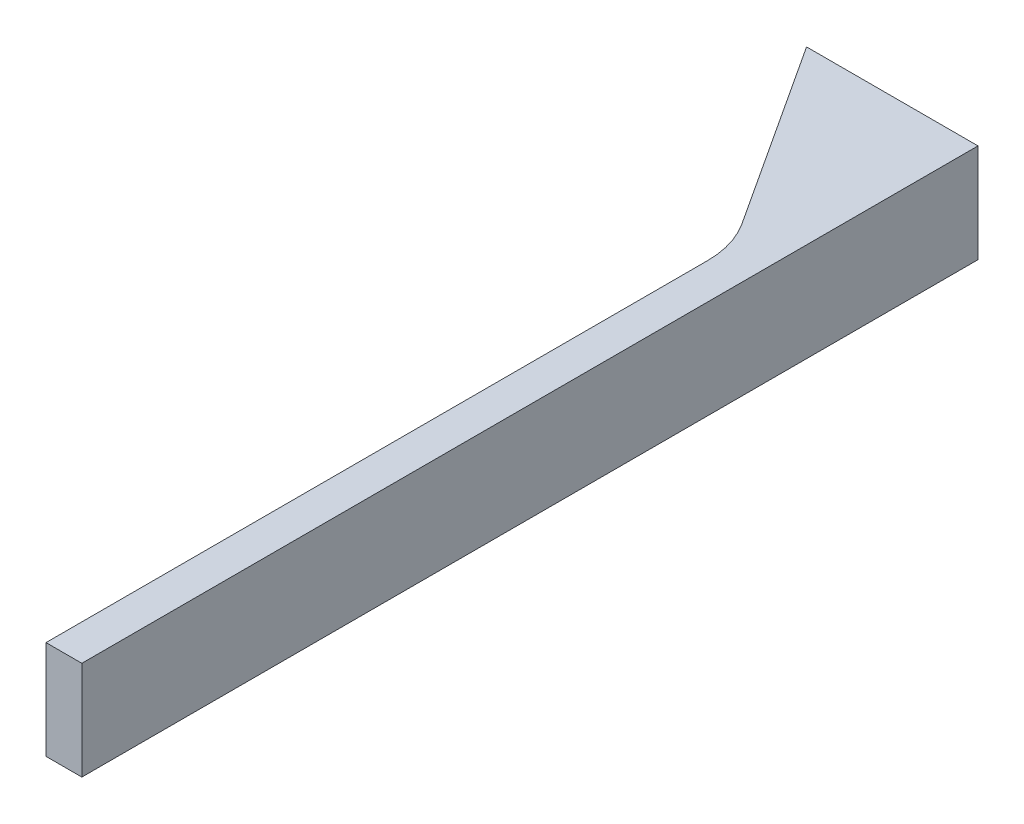
from build123d import *

# Parameters (mm, degrees)
CROQUIS1_W              = 4
CROQUIS1_H              = 11
SALIENTE_EXTRUIR1_DEPTH = 100
SALIENTE_EXTRUIR2_DEPTH = 11
REDONDEO1_R             = 10


with BuildPart() as part:
    # Croquis1 → Saliente-Extruir1 (new body)
    with BuildSketch(Plane.XY):
        with Locations((-13, 0)):
            Rectangle(CROQUIS1_W, CROQUIS1_H)
    extrude(amount=-SALIENTE_EXTRUIR1_DEPTH)

    # Croquis3 → Saliente-Extruir2 (add)
    with BuildSketch(Plane.XZ.offset(5.5)):
        Polygon((-15, -100), (-30.130974356, -100), (-15, -76.782527914), align=None)
    extrude(amount=-SALIENTE_EXTRUIR2_DEPTH)

    # Redondeo1
    redondeo1_edges = [part.edges().sort_by_distance(p)[0] for p in [
        (-15, 0, -76.782527914),
    ]]
    fillet(redondeo1_edges, radius=REDONDEO1_R)


solid = part.part
